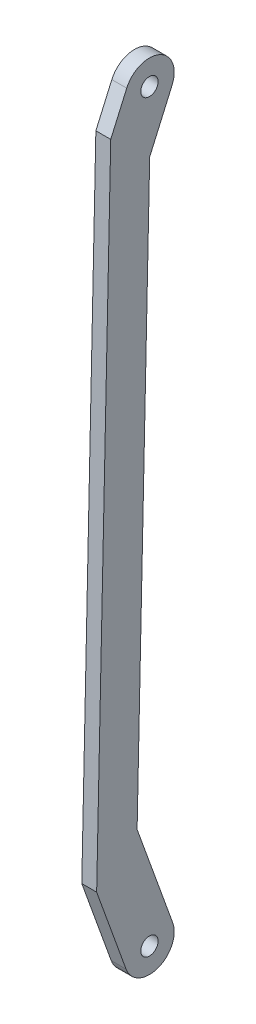
from build123d import *

# Parameters (mm, degrees)
CROQUIS1_R              = 1.75
SALIENTE_EXTRUIR1_DEPTH = 3


with BuildPart() as part:
    # Croquis1 → Saliente-Extruir1 (new body)
    with BuildSketch(Plane(origin=(0, 0, 0), x_dir=(0, 0, -1), z_dir=(1, 0, 0))):
        with BuildLine():
            Line((4.703111933, 1.793661764), (-2.482700505, 21.6730463))
            Line((-2.482700505, 21.6730463), (0.053198949, 137.784671118))
            Line((0.053198949, 137.784671118), (4.5784072, 148.082410318))
            ThreePointArc((4.5784072, 148.082410318), (2.012416575, 154.671468833), (-4.57664194, 152.105478208))
            Line((-4.57664194, 152.105478208), (-7.795940026, 144.779518768))
            Line((-7.795940026, 144.779518768), (-10.634536468, 14.808259621))
            Line((-10.634536468, 14.808259621), (-4.701346672, -1.605773238))
            ThreePointArc((-4.701346672, -1.605773238), (1.700600132, -4.60828504), (4.703111933, 1.793661764))
        make_face()
        with Locations((0.00088263, 150.093944263)):
            Circle(CROQUIS1_R, mode=Mode.SUBTRACT)
        with Locations((0.00088263, 0.093944263)):
            Circle(CROQUIS1_R, mode=Mode.SUBTRACT)
    extrude(amount=SALIENTE_EXTRUIR1_DEPTH)


solid = part.part
